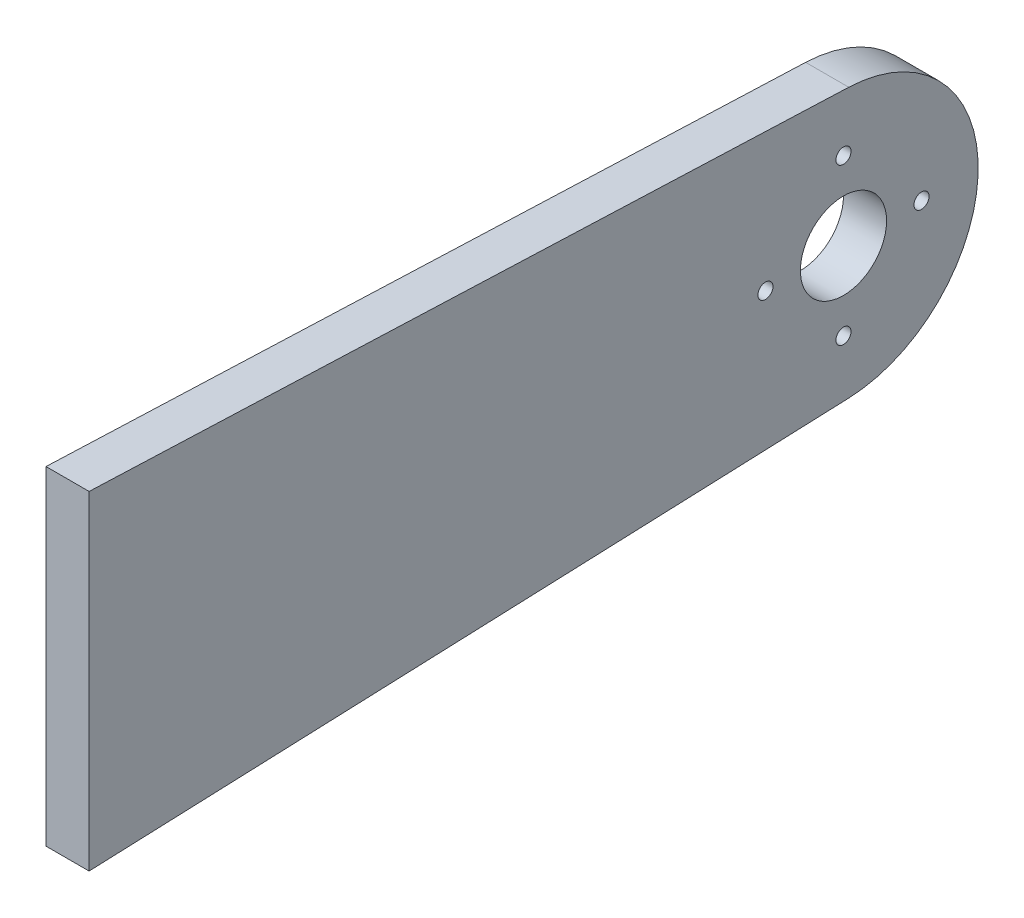
from build123d import *

# Parameters (mm, degrees)
SKETCH1_R           = 4
SKETCH1_R_2         = 0.7
BOSS_EXTRUDE1_DEPTH = 4


with BuildPart() as part:
    # Sketch1 → Boss-Extrude1 (new body)
    with BuildSketch(Plane(origin=(0, 0, 0), x_dir=(0, 0, -1), z_dir=(1, 0, 0))):
        with BuildLine():
            Line((-70, 15.254804339), (-70, -15.254804339))
            Line((-70, -15.254804339), (0.489836976, -12.490398702))
            ThreePointArc((0.489836976, -12.490398702), (12.5, 0), (0.489836976, 12.490398702))
            Line((0.489836976, 12.490398702), (-70, 15.254804339))
        make_face()
        Circle(SKETCH1_R, mode=Mode.SUBTRACT)
        with Locations((-7.24, 0)):
            Circle(SKETCH1_R_2, mode=Mode.SUBTRACT)
        with Locations((0, 7.24)):
            Circle(SKETCH1_R_2, mode=Mode.SUBTRACT)
        with Locations((7.24, 0)):
            Circle(SKETCH1_R_2, mode=Mode.SUBTRACT)
        with Locations((0, -7.24)):
            Circle(SKETCH1_R_2, mode=Mode.SUBTRACT)
    extrude(amount=BOSS_EXTRUDE1_DEPTH)


solid = part.part
